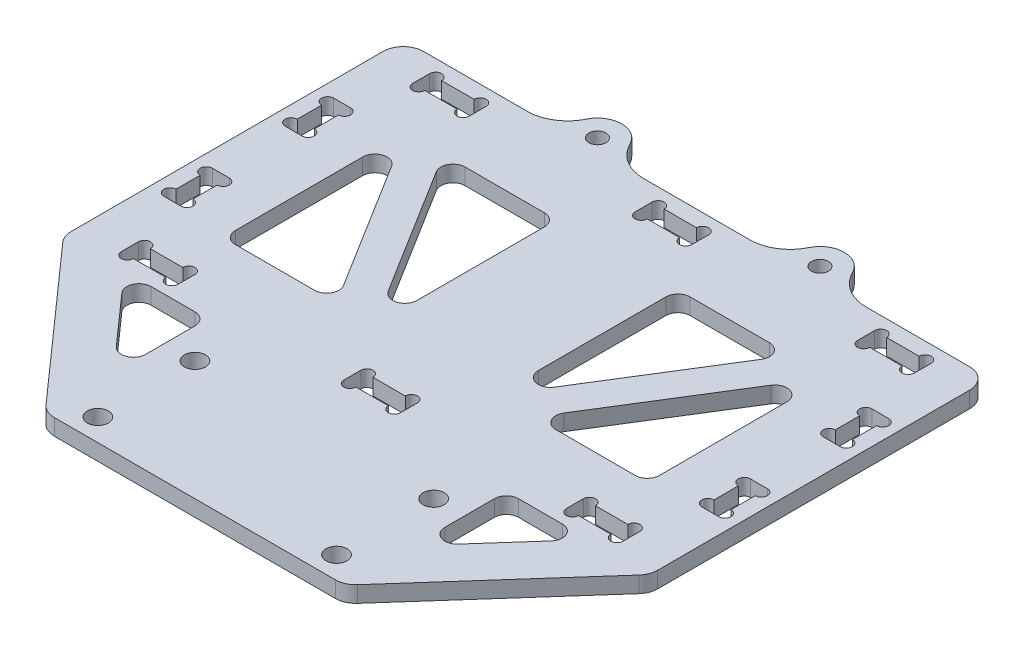
from build123d import *

# Parameters (mm, degrees)
EXTRUDE_1_DEPTH     = 4
SKETCH_2_R          = 2.6
CUT_EXTRUDE_1_DEPTH = 4
SKETCH_3_R          = 1.5
SKETCH_3_W          = 14
SKETCH_3_H          = 4.2
CUT_EXTRUDE_2_DEPTH = 4
EXTRUDE_2_DEPTH     = 4
SKETCH_5_R          = 6
SKETCH_5_R_2        = 2.1
EXTRUDE_3_DEPTH     = 4
FILLET_1_R          = 10
FILLET_2_R          = 3
SKETCH_6_R          = 1.5
SKETCH_6_W          = 4.2
SKETCH_6_H          = 12
CUT_EXTRUDE_3_DEPTH = 10
CUT_EXTRUDE_4_DEPTH = 5
FILLET_3_R          = 3
FILLET_4_R          = 5


with BuildPart() as part:
    # 草图1 → 凸台-拉伸1 (new body)
    with BuildSketch(Plane(origin=(0, 0, 0), x_dir=(1, 0, 0), z_dir=(0, 1, 0))):
        Polygon((-37, 0), (37, 0), (37, 40), (72.5, 40), (72.5, 124), (-72.5, 124), (-72.5, 40), (-37, 40), align=None)
    extrude(amount=EXTRUDE_1_DEPTH)

    # 草图2 → 切除-拉伸1 (cut)
    with BuildSketch(Plane(origin=(0, 4, 0), x_dir=(1, 0, 0), z_dir=(0, 1, 0))):
        with Locations(Location((29.5, 5.5, 0), (0, 0, 270))):
            Circle(SKETCH_2_R)
        with Locations(Location((-29.5, 5.5, 0), (0, 0, 270))):
            Circle(SKETCH_2_R)
        with Locations(Location((29.5, 29.5, 0), (0, 0, 90))):
            Circle(SKETCH_2_R)
        with Locations(Location((-29.5, 29.5, 0), (0, 0, 90))):
            Circle(SKETCH_2_R)
    extrude(amount=-CUT_EXTRUDE_1_DEPTH, mode=Mode.SUBTRACT)

    # 草图3 → 切除-拉伸2 (cut)
    with BuildSketch(Plane(origin=(0, 4, 0), x_dir=(1, 0, 0), z_dir=(0, 1, 0))):
        with Locations((-5.5, 120)):
            Circle(SKETCH_3_R)
        with Locations((-5.5, 115.8)):
            Circle(SKETCH_3_R)
        with Locations((5.5, 120)):
            Circle(SKETCH_3_R)
        with Locations((5.5, 115.8)):
            Circle(SKETCH_3_R)
        with Locations((49.5, 115.8)):
            Circle(SKETCH_3_R)
        with Locations((49.5, 120)):
            Circle(SKETCH_3_R)
        with Locations((60.5, 120)):
            Circle(SKETCH_3_R)
        with Locations((60.5, 115.8)):
            Circle(SKETCH_3_R)
        with Locations((-60.5, 115.8)):
            Circle(SKETCH_3_R)
        with Locations((-60.5, 120)):
            Circle(SKETCH_3_R)
        with Locations((-49.5, 120)):
            Circle(SKETCH_3_R)
        with Locations((-49.5, 115.8)):
            Circle(SKETCH_3_R)
        with Locations((-49.5, 48)):
            Circle(SKETCH_3_R)
        with Locations((-49.5, 43.8)):
            Circle(SKETCH_3_R)
        with Locations((-60.5, 43.8)):
            Circle(SKETCH_3_R)
        with Locations((-60.5, 48)):
            Circle(SKETCH_3_R)
        with Locations((60.5, 48)):
            Circle(SKETCH_3_R)
        with Locations((60.5, 43.8)):
            Circle(SKETCH_3_R)
        with Locations((49.5, 43.8)):
            Circle(SKETCH_3_R)
        with Locations((49.5, 48)):
            Circle(SKETCH_3_R)
        with Locations((5.5, 48)):
            Circle(SKETCH_3_R)
        with Locations((5.5, 43.8)):
            Circle(SKETCH_3_R)
        with Locations((-5.5, 48)):
            Circle(SKETCH_3_R)
        with Locations((-5.5, 43.8)):
            Circle(SKETCH_3_R)
        with Locations((0, 117.9)):
            Rectangle(SKETCH_3_W, SKETCH_3_H)
        with Locations((55, 117.9)):
            Rectangle(SKETCH_3_W, SKETCH_3_H)
        with Locations((-55, 117.9)):
            Rectangle(SKETCH_3_W, SKETCH_3_H)
        with Locations((-55, 45.9)):
            Rectangle(SKETCH_3_W, SKETCH_3_H)
        with Locations((55, 45.9)):
            Rectangle(SKETCH_3_W, SKETCH_3_H)
        with Locations((0, 45.9)):
            Rectangle(SKETCH_3_W, SKETCH_3_H)
    extrude(amount=-CUT_EXTRUDE_2_DEPTH, mode=Mode.SUBTRACT)

    # 草图4 → 凸台-拉伸2 (add)
    with BuildSketch(Plane(origin=(0, 4, 0), x_dir=(1, 0, 0), z_dir=(0, 1, 0))):
        Polygon((-72.5, 40), (-37, 0), (-37, 16.901408451), (-57.5, 40), align=None)
        Polygon((37, 16.901408451), (37, 0), (72.5, 40), (57.5, 40), align=None)
    extrude(amount=-EXTRUDE_2_DEPTH)

    # 草图5 → 凸台-拉伸3 (add)
    # profile 1 of 2: a face of its own
    with BuildSketch(Plane(origin=(0, 4, 0), x_dir=(1, 0, 0), z_dir=(0, 1, 0))):
        with Locations((-27.5, 127)):
            Circle(SKETCH_5_R)
        with Locations(Location((-27.5, 127, 0), (0, 0, 270))):
            Circle(SKETCH_5_R_2, mode=Mode.SUBTRACT)
    # profile 2 of 2: a face of its own
    with BuildSketch(Plane(origin=(0, 4, 0), x_dir=(1, 0, 0), z_dir=(0, 1, 0))):
        with Locations((27.5, 127)):
            Circle(SKETCH_5_R)
        with Locations(Location((27.5, 127, 0), (0, 0, 270))):
            Circle(SKETCH_5_R_2, mode=Mode.SUBTRACT)
    extrude(amount=-EXTRUDE_3_DEPTH)

    # 圆角1
    fillet_1_edges = [part.edges().sort_by_distance(p)[0] for p in [
        (22.303847577, 2, -124),
        (32.696152423, 2, -124),
        (-32.696152423, 2, -124),
        (-22.303847577, 2, -124),
    ]]
    fillet(fillet_1_edges, radius=FILLET_1_R)

    # 圆角2
    fillet_2_edges = [part.edges().sort_by_distance(p)[0] for p in [
        (-37, 2, -40),
        (37, 2, -40),
        (-57.5, 2, -40),
        (-37, 2, -16.901408451),
        (37, 2, -16.901408451),
        (57.5, 2, -40),
    ]]
    fillet(fillet_2_edges, radius=FILLET_2_R)

    # 草图6 → 切除-拉伸3 (cut)
    with BuildSketch(Plane(origin=(0, 4, 0), x_dir=(1, 0, 0), z_dir=(0, 1, 0))):
        with BuildLine():
            ThreePointArc((64.4, 63.9), (62.9, 62.4), (64.4, 60.9))
            Line((64.4, 60.9), (64.4, 63.9))
        make_face()
        with BuildLine():
            Line((64.4, 63.9), (64.4, 60.9))
            ThreePointArc((64.4, 60.9), (65.460660172, 61.339339828), (65.9, 62.4))
            ThreePointArc((65.9, 62.4), (65.460660172, 63.460660172), (64.4, 63.9))
        make_face()
        with Locations((68.6, 62.4)):
            Circle(SKETCH_6_R)
        with Locations((68.6, 71.4)):
            Circle(SKETCH_6_R)
        with Locations((64.4, 71.4)):
            Circle(SKETCH_6_R)
        with Locations((64.4, 62.4)):
            Circle(SKETCH_6_R)
        with Locations((66.5, 66.9)):
            Rectangle(SKETCH_6_W, SKETCH_6_H)
        with BuildLine():
            ThreePointArc((68.6, 63.9), (67.1, 62.4), (68.6, 60.9))
            Line((68.6, 60.9), (68.6, 63.9))
        make_face()
        with BuildLine():
            Line((68.6, 63.9), (68.6, 60.9))
            ThreePointArc((68.6, 60.9), (69.660660172, 61.339339828), (70.1, 62.4))
            ThreePointArc((70.1, 62.4), (69.660660172, 63.460660172), (68.6, 63.9))
        make_face()
        with BuildLine():
            ThreePointArc((68.6, 72.9), (67.1, 71.4), (68.6, 69.9))
            Line((68.6, 69.9), (68.6, 72.9))
        make_face()
        with BuildLine():
            Line((68.6, 72.9), (68.6, 69.9))
            ThreePointArc((68.6, 69.9), (69.660660172, 70.339339828), (70.1, 71.4))
            ThreePointArc((70.1, 71.4), (69.660660172, 72.460660172), (68.6, 72.9))
        make_face()
        with BuildLine():
            ThreePointArc((64.4, 72.9), (62.9, 71.4), (64.4, 69.9))
            Line((64.4, 69.9), (64.4, 72.9))
        make_face()
        with BuildLine():
            Line((64.4, 72.9), (64.4, 69.9))
            ThreePointArc((64.4, 69.9), (65.460660172, 70.339339828), (65.9, 71.4))
            ThreePointArc((65.9, 71.4), (65.460660172, 72.460660172), (64.4, 72.9))
        make_face()
        with BuildLine():
            ThreePointArc((65.9, 92.4), (65.460660172, 93.460660172), (64.4, 93.9))
            Line((64.4, 93.9), (64.4, 90.9))
            ThreePointArc((64.4, 90.9), (65.460660172, 91.339339828), (65.9, 92.4))
        make_face()
        with BuildLine():
            Line((64.4, 90.9), (64.4, 93.9))
            ThreePointArc((64.4, 93.9), (62.9, 92.4), (64.4, 90.9))
        make_face()
        with BuildLine():
            ThreePointArc((65.9, 101.4), (65.460660172, 102.460660172), (64.4, 102.9))
            Line((64.4, 102.9), (64.4, 99.9))
            ThreePointArc((64.4, 99.9), (65.460660172, 100.339339828), (65.9, 101.4))
        make_face()
        with BuildLine():
            Line((64.4, 99.9), (64.4, 102.9))
            ThreePointArc((64.4, 102.9), (62.9, 101.4), (64.4, 99.9))
        make_face()
        with Locations((68.6, 92.4)):
            Circle(SKETCH_6_R)
        with Locations((68.6, 101.4)):
            Circle(SKETCH_6_R)
        with Locations((64.4, 101.4)):
            Circle(SKETCH_6_R)
        with Locations((64.4, 92.4)):
            Circle(SKETCH_6_R)
        with Locations((66.5, 96.9)):
            Rectangle(SKETCH_6_W, SKETCH_6_H)
        with BuildLine():
            ThreePointArc((70.1, 92.4), (69.660660172, 93.460660172), (68.6, 93.9))
            Line((68.6, 93.9), (68.6, 90.9))
            ThreePointArc((68.6, 90.9), (69.660660172, 91.339339828), (70.1, 92.4))
        make_face()
        with BuildLine():
            Line((68.6, 90.9), (68.6, 93.9))
            ThreePointArc((68.6, 93.9), (67.1, 92.4), (68.6, 90.9))
        make_face()
        with BuildLine():
            ThreePointArc((70.1, 101.4), (69.660660172, 102.460660172), (68.6, 102.9))
            Line((68.6, 102.9), (68.6, 99.9))
            ThreePointArc((68.6, 99.9), (69.660660172, 100.339339828), (70.1, 101.4))
        make_face()
        with BuildLine():
            Line((68.6, 99.9), (68.6, 102.9))
            ThreePointArc((68.6, 102.9), (67.1, 101.4), (68.6, 99.9))
        make_face()
    cut_extrude_3 = extrude(amount=-CUT_EXTRUDE_3_DEPTH, mode=Mode.SUBTRACT)

    # 草图7 → 切除-拉伸4 (cut)
    with BuildSketch(Plane(origin=(0, 4, 0), x_dir=(1, 0, 0), z_dir=(0, 1, 0))):
        Polygon((-52.422222222, 104.4), (-52.422222222, 59.4), (-24.422222222, 59.4), align=None)
        Polygon((-43, 104.4), (-15, 59.4), (-15, 104.4), align=None)
        Polygon((15, 104.4), (43, 104.4), (15, 59.4), align=None)
        Polygon((24.422222222, 59.4), (52.422222222, 104.4), (52.422222222, 59.4), align=None)
    extrude(amount=-CUT_EXTRUDE_4_DEPTH, mode=Mode.SUBTRACT)

    # 圆角3
    fillet_3_edges = [part.edges().sort_by_distance(p)[0] for p in [
        (-43, 2, -104.4),
        (-15, 2, -104.4),
        (-15, 2, -59.4),
        (15, 2, -59.4),
        (15, 2, -104.4),
        (43, 2, -104.4),
        (52.422222222, 2, -59.4),
        (24.422222222, 2, -59.4),
        (52.422222222, 2, -104.4),
        (-52.422222222, 2, -104.4),
        (-24.422222222, 2, -59.4),
        (-52.422222222, 2, -59.4),
    ]]
    fillet(fillet_3_edges, radius=FILLET_3_R)

    # 镜向1: 切除-拉伸3 across plane
    add(cut_extrude_3.mirror(Plane(origin=(0, 0, 0), x_dir=(0, 0, 1), z_dir=(1, 0, 0))), mode=Mode.SUBTRACT)

    # 圆角4
    fillet_4_edges = [part.edges().sort_by_distance(p)[0] for p in [
        (37, 2, 0),
        (-37, 2, 0),
        (-72.5, 2, -40),
        (-72.5, 2, -124),
        (72.5, 2, -124),
        (72.5, 2, -40),
    ]]
    fillet(fillet_4_edges, radius=FILLET_4_R)


solid = part.part
